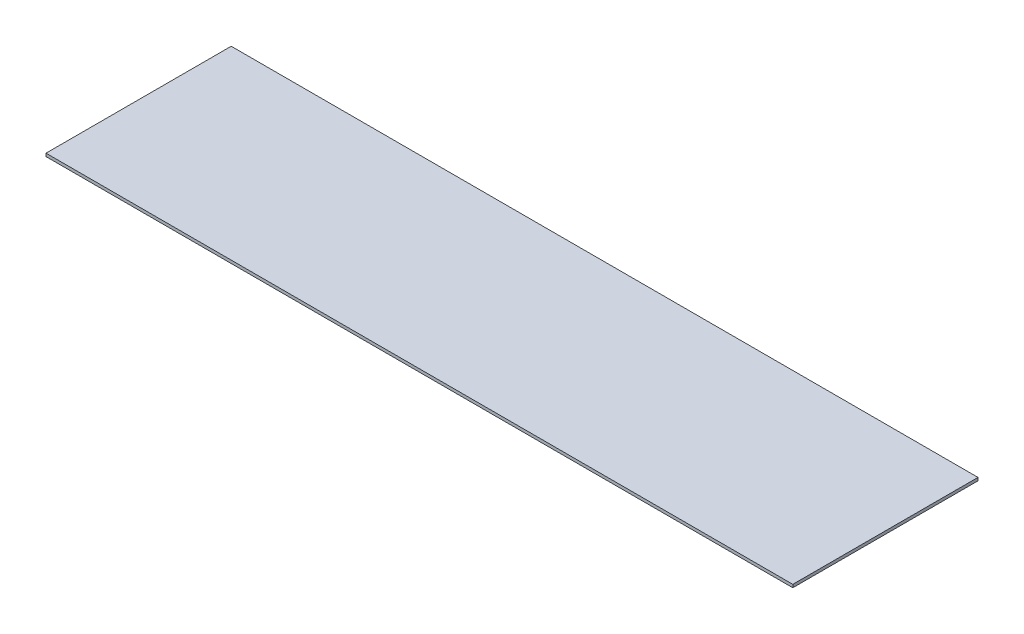
from build123d import *

# Parameters (mm, degrees)
SKETCH2_W           = 250
SKETCH2_H           = 62
BOSS_EXTRUDE1_DEPTH = 1


with BuildPart() as part:
    # Sketch2 → Boss-Extrude1 (new body)
    with BuildSketch(Plane(origin=(0, 0, 0), x_dir=(1, 0, 0), z_dir=(0, 1, 0))):
        with Locations((13.510638298, -50.457446809)):
            Rectangle(SKETCH2_W, SKETCH2_H)
    extrude(amount=BOSS_EXTRUDE1_DEPTH)


solid = part.part
